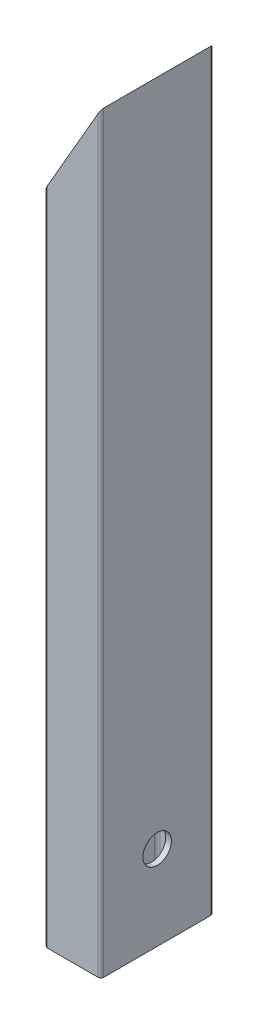
from build123d import *

# Parameters (mm, degrees)
BOSS_EXTRU_1_DEPTH      = 675
ESQUISSE3_R             = 10.125
ESQUISSE3_R_2           = 12.5
ENL_V_MAT_EXTRU_1_DEPTH = 681.900139521
ENL_V_MAT_EXTRU_2_DEPTH = 681.900139521


with BuildPart() as part:
    # Esquisse2 → Boss.-Extru.1 (new body)
    with BuildSketch(Plane(origin=(0, 0, 0), x_dir=(1, 0, 0), z_dir=(0, 1, 0))):
        with BuildLine():
            Line((2, 0), (38, 0))
            ThreePointArc((38, 0), (39.414213562, 0.585786438), (40, 2))
            Line((40, 2), (40, 78))
            ThreePointArc((40, 78), (39.414213562, 79.414213562), (38, 80))
            Line((38, 80), (2, 80))
            ThreePointArc((2, 80), (0.585786438, 79.414213562), (0, 78))
            Line((0, 78), (0, 2))
            ThreePointArc((0, 2), (0.585786438, 0.585786438), (2, 0))
        make_face()
        with BuildLine():
            Line((6, 4), (34, 4))
            ThreePointArc((34, 4), (35.414213562, 4.585786438), (36, 6))
            Line((36, 6), (36, 74))
            ThreePointArc((36, 74), (35.414213562, 75.414213562), (34, 76))
            Line((34, 76), (6, 76))
            ThreePointArc((6, 76), (4.585786438, 75.414213562), (4, 74))
            Line((4, 74), (4, 6))
            ThreePointArc((4, 6), (4.585786438, 4.585786438), (6, 4))
        make_face(mode=Mode.SUBTRACT)
    extrude(amount=BOSS_EXTRU_1_DEPTH)

    # Esquisse3 → Enlèv. mat.-Extru.1 (cut, through all)
    with BuildSketch(Plane(origin=(40, 0, 0), x_dir=(0, 0, -1), z_dir=(1, 0, 0))):
        with Locations((40, 60)):
            Circle(ESQUISSE3_R)
        with Locations((40, 635)):
            Circle(ESQUISSE3_R_2)
    extrude(amount=-ENL_V_MAT_EXTRU_1_DEPTH, mode=Mode.SUBTRACT)

    # Esquisse4 → Enlèv. mat.-Extru.2 (cut, through all)
    with BuildSketch(Plane.XY):
        Polygon((0, 675), (40, 675), (40, 535), (0, 465.717967697), align=None)
    extrude(amount=-ENL_V_MAT_EXTRU_2_DEPTH, mode=Mode.SUBTRACT)


solid = part.part
